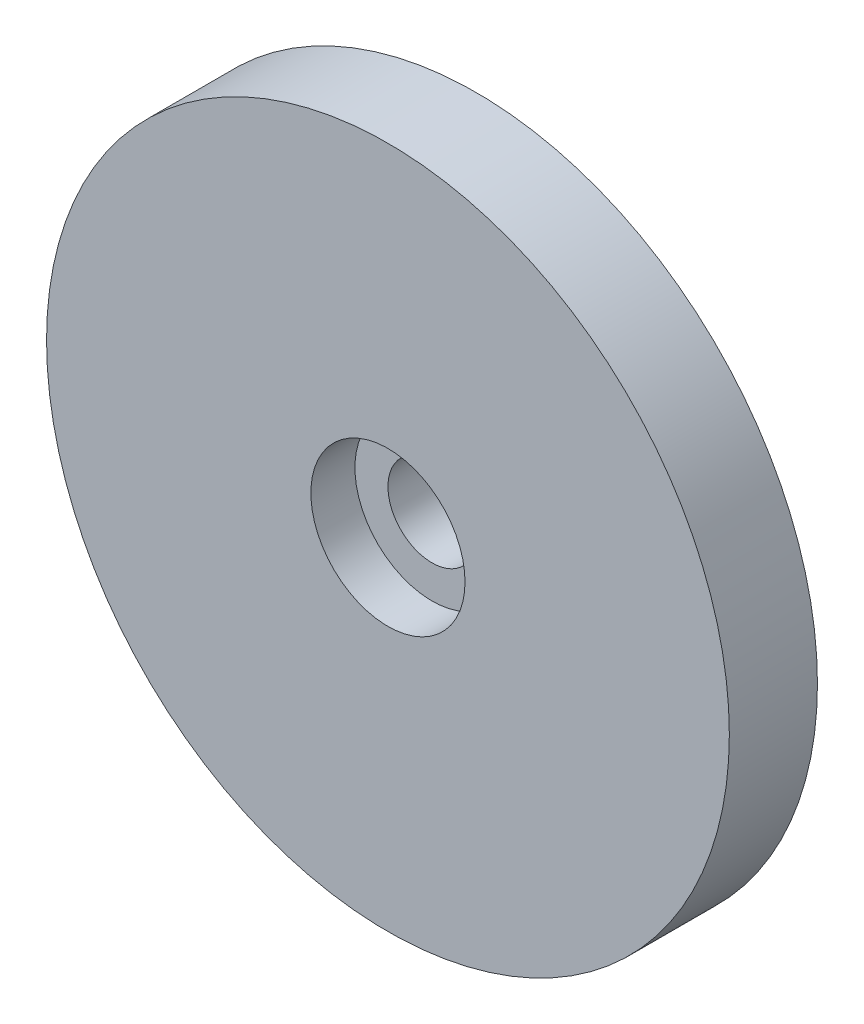
from build123d import *

# Parameters (mm, degrees)
SKETCH_1_R          = 7.75
EXTRUDE_1_DEPTH     = 2
SKETCH_2_R          = 1
CUT_EXTRUDE_1_DEPTH = 12.141139978
SKETCH_2_3_R        = 1.75
SKETCH_2_3_R_2      = 1
CUT_EXTRUDE_2_DEPTH = 1


with BuildPart() as part:
    # 草图1 → 凸台-拉伸1 (new body)
    with BuildSketch(Plane.XY):
        Circle(SKETCH_1_R)
    extrude(amount=EXTRUDE_1_DEPTH)

    # 草图2 → 切除-拉伸1 (cut, through all)
    with BuildSketch(Plane.XY.offset(2)):
        Circle(SKETCH_2_R)
    extrude(amount=-CUT_EXTRUDE_1_DEPTH, mode=Mode.SUBTRACT)

    # 草图2<3> → 切除-拉伸2 (cut)
    with BuildSketch(Plane.XY.offset(2)):
        Circle(SKETCH_2_3_R)
        Circle(SKETCH_2_3_R_2, mode=Mode.SUBTRACT)
    extrude(amount=-CUT_EXTRUDE_2_DEPTH, mode=Mode.SUBTRACT)


solid = part.part
